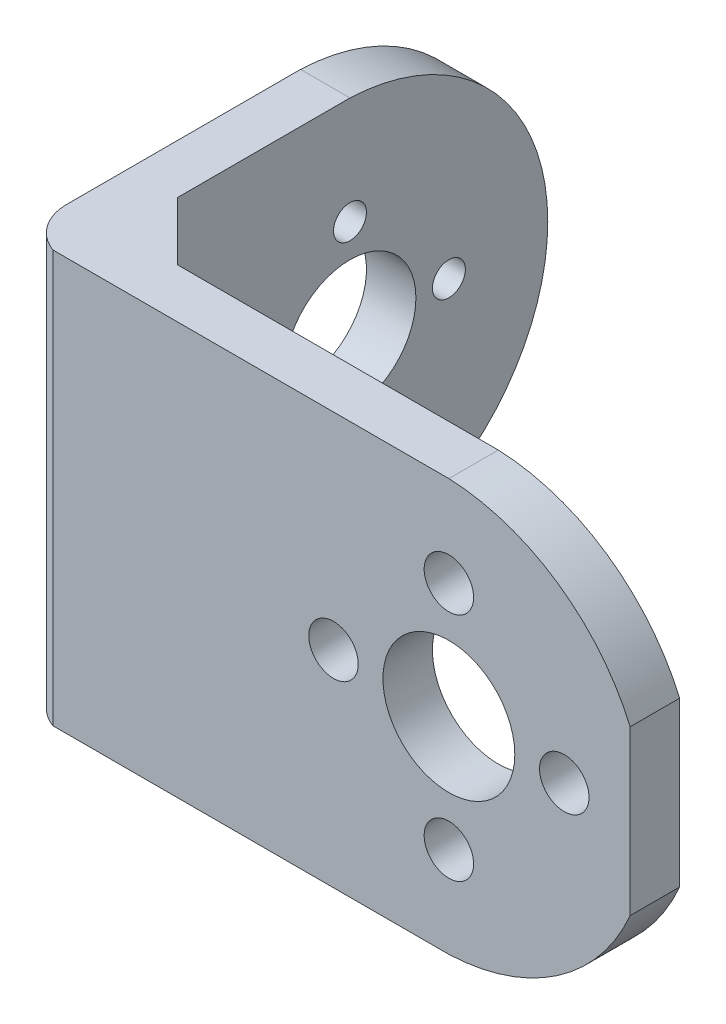
from build123d import *

# Parameters (mm, degrees)
BOSS_EXTRUDE1_DEPTH = 25
CUT_EXTRUDE1_DEPTH  = 25
CUT_EXTRUDE2_DEPTH  = 25
SKETCH5_R           = 4
SKETCH5_R_2         = 1.5
CUT_EXTRUDE3_DEPTH  = 25
SKETCH6_R           = 4
SKETCH6_R_2         = 1
CUT_EXTRUDE4_DEPTH  = 25
BOSS_EXTRUDE2_DEPTH = 25


with BuildPart() as part:
    # Sketch1 → Boss-Extrude1 (new body)
    with BuildSketch(Plane(origin=(0, 0, 0), x_dir=(1, 0, 0), z_dir=(0, 1, 0))):
        with BuildLine():
            ThreePointArc((-1, 1.659075407), (-0.409273776, 0.032355851), (0.979760199, -1))
            Line((0.979760199, -1), (3.029390137, -1))
            Line((3.029390137, -1), (36, -1))
            Line((36, -1), (36, 2))
            Line((36, 2), (3.038729714, 2))
            ThreePointArc((3.038729714, 2), (3.003147911, 1.999369152), (2.967566108, 2))
            ThreePointArc((2.967566108, 2), (2.293369144, 2.293369144), (2, 2.967566108))
            Line((2, 2.967566108), (2, 28))
            Line((2, 28), (-1, 28))
            Line((-1, 28), (-1, 2))
            Line((-1, 2), (-1, 1.659075407))
        make_face()
    extrude(amount=BOSS_EXTRUDE1_DEPTH)

    # Sketch2 → Cut-Extrude1 (cut)
    with BuildSketch(Plane.ZY.offset(1)):
        with BuildLine():
            ThreePointArc((-28, 12.5), (-24.514439297, 21.163861726), (-16, 25))
            Line((-16, 25), (-28, 25))
            Line((-28, 25), (-28, 12.5))
        make_face()
        with BuildLine():
            ThreePointArc((-16, 0), (-24.514439297, 3.836138274), (-28, 12.5))
            Line((-28, 12.5), (-28, 0))
            Line((-28, 0), (-16, 0))
        make_face()
    extrude(amount=-CUT_EXTRUDE1_DEPTH, mode=Mode.SUBTRACT)

    # Sketch4 → Cut-Extrude2 (cut)
    with BuildSketch(Plane.XY.offset(1)):
        with BuildLine():
            Line((36, 25), (25, 25))
            ThreePointArc((25, 25), (31.588282141, 22.818684163), (36, 17.461413786))
            Line((36, 17.461413786), (36, 25))
        make_face()
        with BuildLine():
            Line((36, 0), (36, 7.538586214))
            ThreePointArc((36, 7.538586214), (31.588282141, 2.181315837), (25, 0))
            Line((25, 0), (36, 0))
        make_face()
    extrude(amount=-CUT_EXTRUDE2_DEPTH, mode=Mode.SUBTRACT)

    # Sketch5 → Cut-Extrude3 (cut)
    with BuildSketch(Plane.XY.offset(1)):
        with Locations((25, 12.5)):
            Circle(SKETCH5_R)
        with Locations((25, 19.5)):
            Circle(SKETCH5_R_2)
        with Locations((32, 12.5)):
            Circle(SKETCH5_R_2)
        with Locations((25, 5.5)):
            Circle(SKETCH5_R_2)
        with Locations((18, 12.5)):
            Circle(SKETCH5_R_2)
    extrude(amount=-CUT_EXTRUDE3_DEPTH, mode=Mode.SUBTRACT)

    # Sketch6 → Cut-Extrude4 (cut)
    with BuildSketch(Plane.ZY.offset(1)):
        with Locations((-16, 12.5)):
            Circle(SKETCH6_R)
        with Locations((-16, 18.5)):
            Circle(SKETCH6_R_2)
        with Locations((-10, 12.5)):
            Circle(SKETCH6_R_2)
        with Locations((-16, 6.5)):
            Circle(SKETCH6_R_2)
        with Locations((-22, 12.5)):
            Circle(SKETCH6_R_2)
    extrude(amount=-CUT_EXTRUDE4_DEPTH, mode=Mode.SUBTRACT)

    # Sketch7 → Boss-Extrude2 (add)
    with BuildSketch(Plane(origin=(0, 25, 0), x_dir=(1, 0, 0), z_dir=(0, 1, 0))):
        Polygon((0.998168154, 6.545186747), (6.456382716, 1.086972186), (0.998168154, 1.086972186), align=None)
    extrude(amount=-BOSS_EXTRUDE2_DEPTH)


solid = part.part
